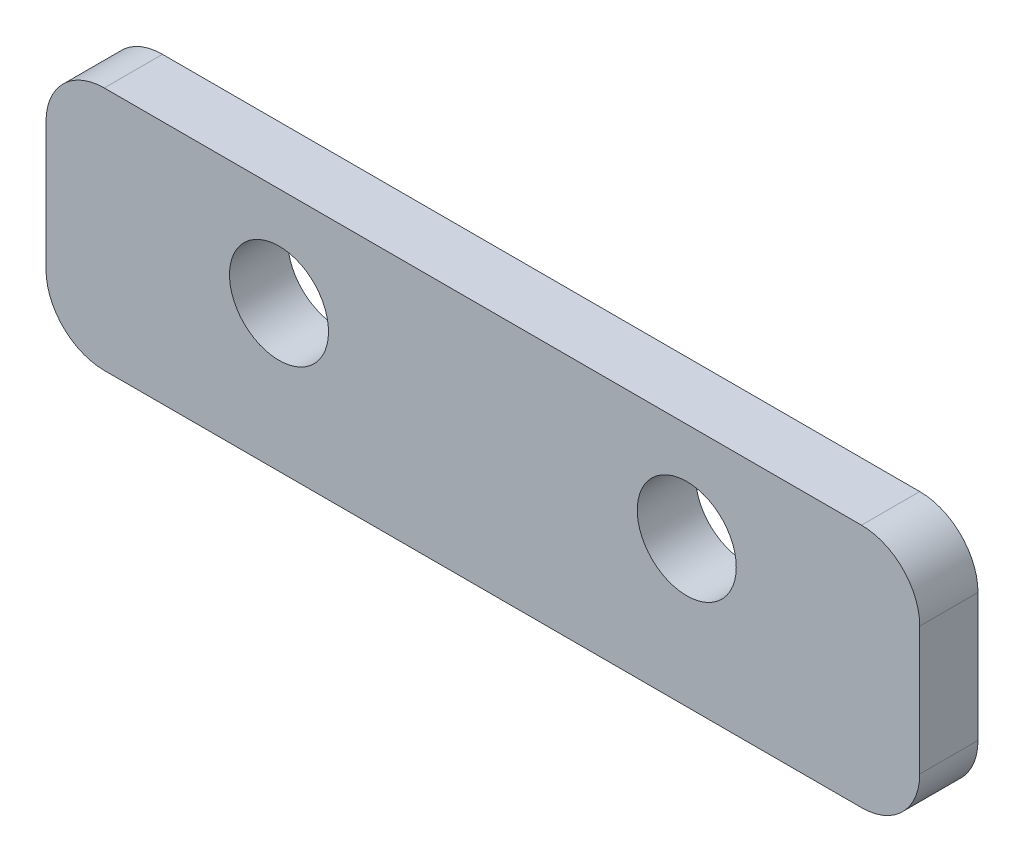
from build123d import *

# Parameters (mm, degrees)
SKETCH1_W            = 30
SKETCH1_H            = 10
BOSS_EXTRUDE1_DEPTH  = 2
M3_CLEARANCE_HOLE1_D = 3.4
SKETCH5_W            = 30
SKETCH5_H            = 2
CUT_EXTRUDE1_DEPTH   = 1.6
FILLET1_R            = 2


with BuildPart() as part:
    # Sketch1 → Boss-Extrude1 (new body)
    with BuildSketch(Plane.XY):
        Rectangle(SKETCH1_W, SKETCH1_H)
    extrude(amount=BOSS_EXTRUDE1_DEPTH)

    # M3 Clearance Hole1 (through all)
    with Locations(Plane.XY.offset(2)):
        with Locations((-7, 0), (7, 0)):
            Hole(M3_CLEARANCE_HOLE1_D / 2)

    # Sketch5 → Cut-Extrude1 (cut)
    with BuildSketch(Plane(origin=(0, 5, 0), x_dir=(1, 0, 0), z_dir=(0, 1, 0))):
        with Locations((0, -1)):
            Rectangle(SKETCH5_W, SKETCH5_H)
    extrude(amount=-CUT_EXTRUDE1_DEPTH, mode=Mode.SUBTRACT)

    # Fillet1
    fillet1_edges = [part.edges().sort_by_distance(p)[0] for p in [
        (15, 3.4, 1),
        (-15, 3.4, 1),
        (15, -5, 1),
        (-15, -5, 1),
    ]]
    fillet(fillet1_edges, radius=FILLET1_R)


solid = part.part
